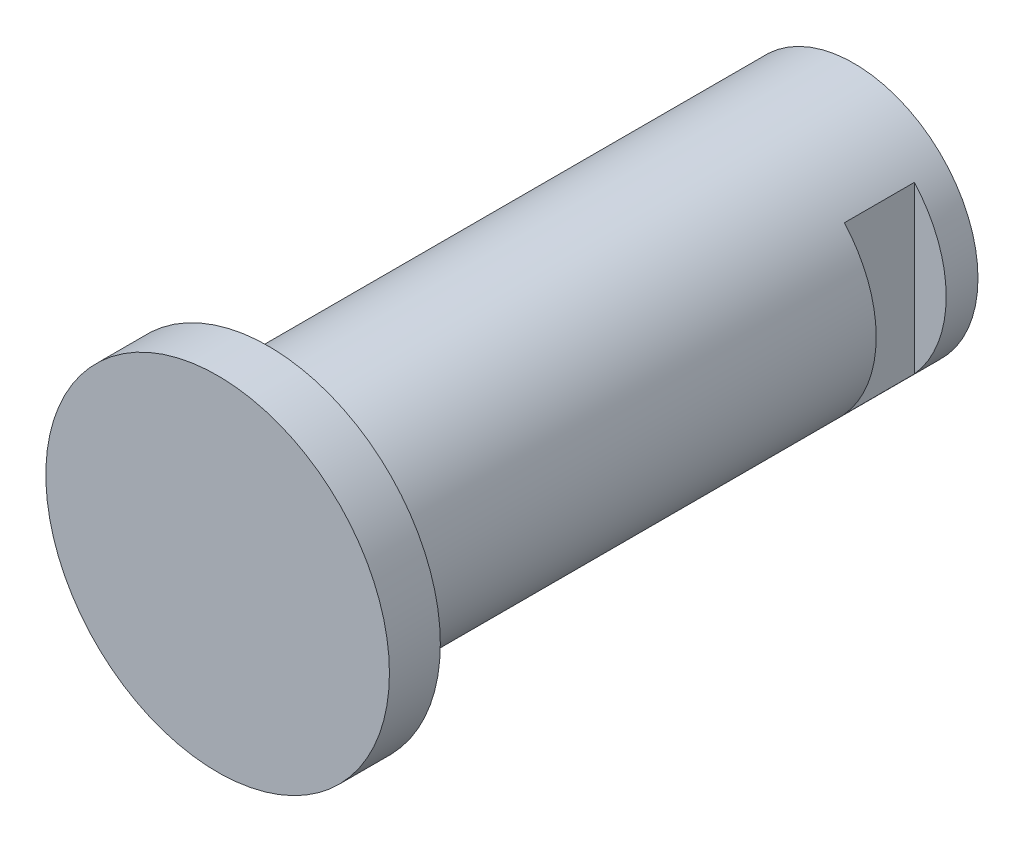
from build123d import *

# Parameters (mm, degrees)
SKETCH1_R               = 4.953
BOSS_EXTRUDE1_DEPTH     = 25.4
SKETCH2_R               = 6.858
BOSS_EXTRUDE2_DEPTH     = 2.032
CUT_EXTRUDE1_DEPTH      = 28.188680145
CUT_EXTRUDE1_DEPTH_BACK = 28.188680145
SKETCH3_W               = 1.27
SKETCH3_H               = 2.794


with BuildPart() as part:
    # Sketch1 → Boss-Extrude1 (new body)
    with BuildSketch(Plane.XY):
        Circle(SKETCH1_R)
    extrude(amount=BOSS_EXTRUDE1_DEPTH)

    # Sketch2 → Boss-Extrude2 (add)
    with BuildSketch(Plane.XY.offset(25.4)):
        Circle(SKETCH2_R)
    extrude(amount=-BOSS_EXTRUDE2_DEPTH)

    # Sketch3 → Cut-Extrude1 (cut, two sides: drawn at the far end of the back side and taken through both)
    with BuildSketch(Plane(origin=(0, 0, 0), x_dir=(1, 0, 0), z_dir=(0, 1, 0)).offset(-CUT_EXTRUDE1_DEPTH_BACK)):
        with Locations((4.318, -2.667)):
            Rectangle(SKETCH3_W, SKETCH3_H)
        with Locations((-4.318, -2.667)):
            Rectangle(SKETCH3_W, SKETCH3_H)
    extrude(amount=CUT_EXTRUDE1_DEPTH + CUT_EXTRUDE1_DEPTH_BACK, mode=Mode.SUBTRACT)


solid = part.part
